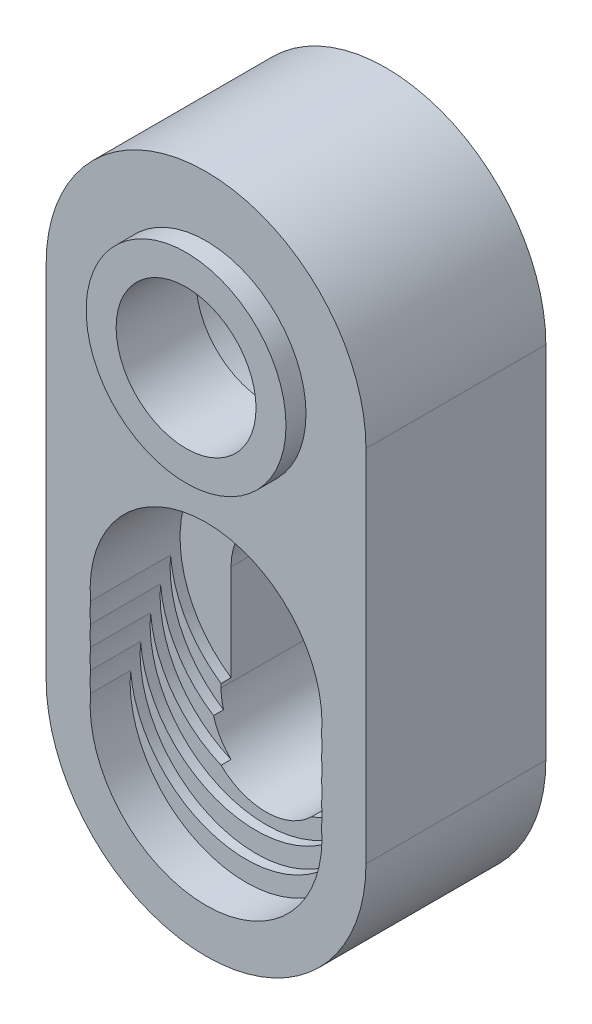
from build123d import *

# Parameters (mm, degrees)
ESBO_O1_R                = 1.75
RESSALTO_EXTRUS_O1_DEPTH = 4.5
ESBO_O2_R                = 2.5
ESBO_O2_R_2              = 1.75
RESSALTO_EXTRUS_O2_DEPTH = 0.5
CORTE_EXTRUS_O1_DEPTH    = 15.326548782
ESBO_O4_R                = 2.9
CORTE_EXTRUS_O2_DEPTH    = 1
ESBO_O5_R                = 2.9
CORTE_EXTRUS_O3_DEPTH    = 1.25
ESBO_O6_R                = 2.9
CORTE_EXTRUS_O4_DEPTH    = 1.5
ESBO_O7_R                = 2.9
CORTE_EXTRUS_O5_DEPTH    = 1.75
ESBO_O8_R                = 2.9
CORTE_EXTRUS_O6_DEPTH    = 2
ESBO_O9_R                = 2.9
CORTE_EXTRUS_O7_DEPTH    = 2.25
ESBO_O10_R               = 2.9
CORTE_EXTRUS_O8_DEPTH    = 3


with BuildPart() as part:
    # Esboço1 → Ressalto-extrusão1 (new body)
    with BuildSketch(Plane.XY):
        with BuildLine():
            Line((-4, 0), (-4, -9))
            ThreePointArc((-4, -9), (0, -13), (4, -9))
            Line((4, -9), (4, 0))
            ThreePointArc((4, 0), (0, 4), (-4, 0))
        make_face()
        Circle(ESBO_O1_R, mode=Mode.SUBTRACT)
    extrude(amount=RESSALTO_EXTRUS_O1_DEPTH)

    # Esboço2 → Ressalto-extrusão2 (add)
    with BuildSketch(Plane.XY.offset(4.5)):
        Circle(ESBO_O2_R)
        Circle(ESBO_O2_R_2, mode=Mode.SUBTRACT)
    extrude(amount=RESSALTO_EXTRUS_O2_DEPTH)

    # Esboço3 → Corte-extrusão1 (cut, through all)
    with BuildSketch(Plane.XY.offset(4.5)):
        with BuildLine():
            Line((-1.625, -6.5), (-1.625, -9))
            ThreePointArc((-1.625, -9), (0, -10.625), (1.625, -9))
            Line((1.625, -9), (1.625, -6.5))
            ThreePointArc((1.625, -6.5), (0, -4.875), (-1.625, -6.5))
        make_face()
    extrude(amount=-CORTE_EXTRUS_O1_DEPTH, mode=Mode.SUBTRACT)

    # Esboço4 → Corte-extrusão2 (cut)
    with BuildSketch(Plane.XY.offset(4.5)):
        with Locations((0, -9)):
            Circle(ESBO_O4_R)
    extrude(amount=-CORTE_EXTRUS_O2_DEPTH, mode=Mode.SUBTRACT)

    # Esboço5 → Corte-extrusão3 (cut)
    with BuildSketch(Plane.XY.offset(4.5)):
        with Locations((0, -8.5)):
            Circle(ESBO_O5_R)
    extrude(amount=-CORTE_EXTRUS_O3_DEPTH, mode=Mode.SUBTRACT)

    # Esboço6 → Corte-extrusão4 (cut)
    with BuildSketch(Plane.XY.offset(4.5)):
        with Locations((0, -8)):
            Circle(ESBO_O6_R)
    extrude(amount=-CORTE_EXTRUS_O4_DEPTH, mode=Mode.SUBTRACT)

    # Esboço7 → Corte-extrusão5 (cut)
    with BuildSketch(Plane.XY.offset(4.5)):
        with Locations((0, -7.5)):
            Circle(ESBO_O7_R)
    extrude(amount=-CORTE_EXTRUS_O5_DEPTH, mode=Mode.SUBTRACT)

    # Esboço8 → Corte-extrusão6 (cut)
    with BuildSketch(Plane.XY.offset(4.5)):
        with Locations((0, -7)):
            Circle(ESBO_O8_R)
    extrude(amount=-CORTE_EXTRUS_O6_DEPTH, mode=Mode.SUBTRACT)

    # Esboço9 → Corte-extrusão7 (cut)
    with BuildSketch(Plane.XY.offset(4.5)):
        with Locations((0, -6.5)):
            Circle(ESBO_O9_R)
    extrude(amount=-CORTE_EXTRUS_O7_DEPTH, mode=Mode.SUBTRACT)

    # Esboço10 → Corte-extrusão8 (cut)
    with BuildSketch(Plane(origin=(0, 0, 0), x_dir=(-1, 0, 0), z_dir=(0, 0, -1))):
        Circle(ESBO_O10_R)
    extrude(amount=-CORTE_EXTRUS_O8_DEPTH, mode=Mode.SUBTRACT)


solid = part.part
